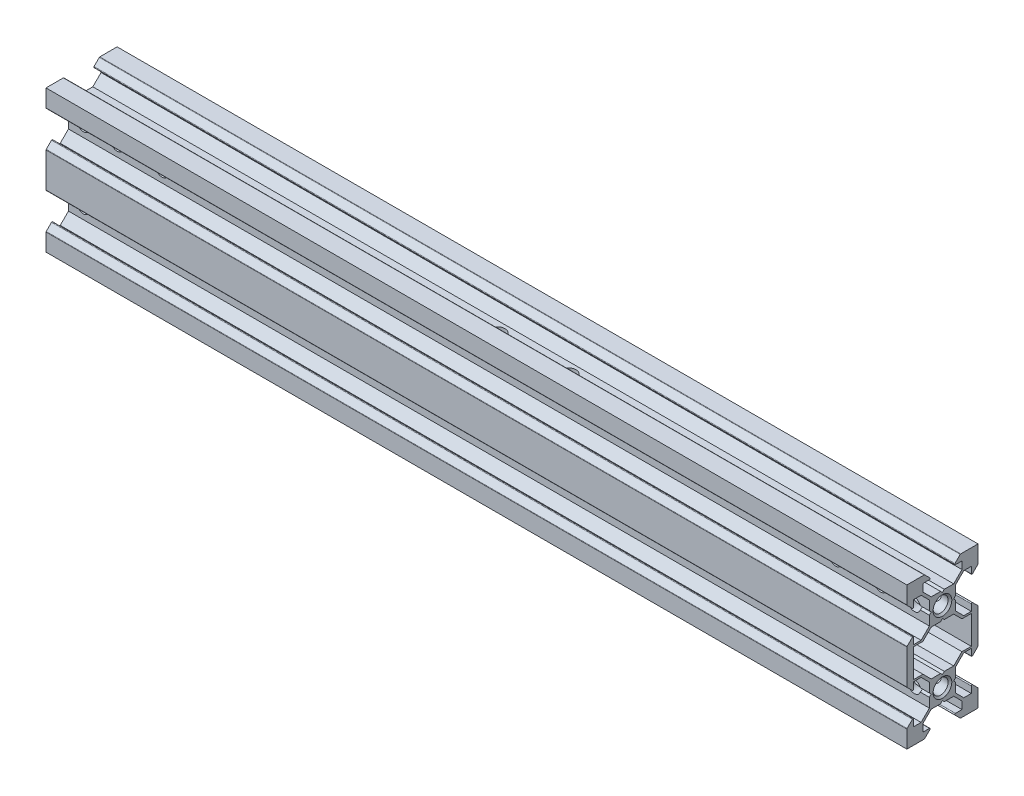
from build123d import *

# Parameters (mm, degrees)
MAIN_BODY_DEPTH       = 115
MAIN_BODY_DEPTH_BACK  = 115
SKETCH2_R             = 2
CHAMFER1_SIZE         = 0.5
CHAMFER2_SIZE         = 0.5
SIDE_HOLES_DEPTH      = 119.858499801
SIDE_HOLES_DEPTH_BACK = 119.858499801
SKETCH3_R             = 1.65
TOP_HOLES_DEPTH       = 10
TOP_HOLES_DEPTH_BACK  = 10
SKETCH4_R             = 2.1


with BuildPart() as part:
    # Sketch2 → Main Body (new, two sides: drawn at the far end of the back side and taken through both)
    with BuildSketch(Plane(origin=(0, 0, 0), x_dir=(0, 0, -1), z_dir=(1, 0, 0)).offset(-MAIN_BODY_DEPTH_BACK)):
        with BuildLine():
            Line((0.5, 3.5), (0, 3))
            Line((0, 3), (-0.5, 3.5))
            Line((-0.5, 3.5), (-3.01, 3.5))
            Line((-3.01, 3.5), (-5.209102089, 5.699102089))
            Line((-5.209102089, 5.699102089), (-5.209102089, 7.699102089))
            Line((-5.209102089, 7.699102089), (-3.479102089, 7.699102089))
            ThreePointArc((-3.479102089, 7.699102089), (-3.294326183, 7.822565403), (-3.337680733, 8.040523446))
            Line((-3.337680733, 8.040523446), (-4.73775216, 9.440594872))
            ThreePointArc((-4.73775216, 9.440594872), (-4.80263683, 9.483949423), (-4.879173516, 9.499173516))
            Line((-4.879173516, 9.499173516), (-9.499173516, 9.499173516))
            Line((-9.499173516, 9.499173516), (-9.499173516, 4.879173516))
            ThreePointArc((-9.499173516, 4.879173516), (-9.483949423, 4.80263683), (-9.440594872, 4.73775216))
            Line((-9.440594872, 4.73775216), (-8.040523446, 3.337680733))
            ThreePointArc((-8.040523446, 3.337680733), (-7.822565403, 3.294326183), (-7.699102089, 3.479102089))
            Line((-7.699102089, 3.479102089), (-7.699102089, 5.209102089))
            Line((-7.699102089, 5.209102089), (-5.699102089, 5.209102089))
            Line((-5.699102089, 5.209102089), (-3.5, 3.01))
            Line((-3.5, 3.01), (-3.5, 0.5))
            Line((-3.5, 0.5), (-3, 0))
            Line((-3, 0), (-3.5, -0.5))
            Line((-3.5, -0.5), (-3.5, -3.01))
            Line((-3.5, -3.01), (-5.699102089, -5.209102089))
            Line((-5.699102089, -5.209102089), (-7.699102089, -5.209102089))
            Line((-7.699102089, -5.209102089), (-7.699102089, -3.479102089))
            ThreePointArc((-7.699102089, -3.479102089), (-7.822565403, -3.294326183), (-8.040523446, -3.337680733))
            Line((-8.040523446, -3.337680733), (-9.440594872, -4.73775216))
            ThreePointArc((-9.440594872, -4.73775216), (-9.483949423, -4.80263683), (-9.499173516, -4.879173516))
            Line((-9.499173516, -4.879173516), (-9.499173516, -14.119173516))
            ThreePointArc((-9.499173516, -14.119173516), (-9.483949423, -14.195710203), (-9.440594872, -14.260594872))
            Line((-9.440594872, -14.260594872), (-8.040523446, -15.660666299))
            ThreePointArc((-8.040523446, -15.660666299), (-7.822565403, -15.704020849), (-7.699102089, -15.519244943))
            Line((-7.699102089, -15.519244943), (-7.699102089, -13.789244943))
            Line((-7.699102089, -13.789244943), (-5.699102089, -13.789244943))
            Line((-5.699102089, -13.789244943), (-3.5, -15.988347032))
            Line((-3.5, -15.988347032), (-3.5, -18.498347032))
            Line((-3.5, -18.498347032), (-3, -18.998347032))
            Line((-3, -18.998347032), (-3.5, -19.498347032))
            Line((-3.5, -19.498347032), (-3.5, -22.008347032))
            Line((-3.5, -22.008347032), (-5.699102089, -24.207449122))
            Line((-5.699102089, -24.207449122), (-7.699102089, -24.207449122))
            Line((-7.699102089, -24.207449122), (-7.699102089, -22.477449122))
            ThreePointArc((-7.699102089, -22.477449122), (-7.822565403, -22.292673215), (-8.040523446, -22.336027766))
            Line((-8.040523446, -22.336027766), (-9.440594872, -23.736099192))
            ThreePointArc((-9.440594872, -23.736099192), (-9.483949423, -23.800983862), (-9.499173516, -23.877520549))
            Line((-9.499173516, -23.877520549), (-9.499173516, -28.497520549))
            Line((-9.499173516, -28.497520549), (-4.879173516, -28.497520549))
            ThreePointArc((-4.879173516, -28.497520549), (-4.80263683, -28.482296455), (-4.73775216, -28.438941905))
            Line((-4.73775216, -28.438941905), (-3.337680733, -27.038870478))
            ThreePointArc((-3.337680733, -27.038870478), (-3.294326183, -26.820912435), (-3.479102089, -26.697449122))
            Line((-3.479102089, -26.697449122), (-5.209102089, -26.697449122))
            Line((-5.209102089, -26.697449122), (-5.209102089, -24.697449122))
            Line((-5.209102089, -24.697449122), (-3.01, -22.498347032))
            Line((-3.01, -22.498347032), (-0.5, -22.498347032))
            Line((-0.5, -22.498347032), (0, -21.998347032))
            Line((0, -21.998347032), (0.5, -22.498347032))
            Line((0.5, -22.498347032), (3.01, -22.498347032))
            Line((3.01, -22.498347032), (5.209102089, -24.697449122))
            Line((5.209102089, -24.697449122), (5.209102089, -26.697449122))
            Line((5.209102089, -26.697449122), (3.479102089, -26.697449122))
            ThreePointArc((3.479102089, -26.697449122), (3.294326183, -26.820912435), (3.337680733, -27.038870478))
            Line((3.337680733, -27.038870478), (4.73775216, -28.438941905))
            ThreePointArc((4.73775216, -28.438941905), (4.80263683, -28.482296455), (4.879173516, -28.497520549))
            Line((4.879173516, -28.497520549), (9.499173516, -28.497520549))
            Line((9.499173516, -28.497520549), (9.499173516, -23.877520549))
            ThreePointArc((9.499173516, -23.877520549), (9.483949423, -23.800983862), (9.440594872, -23.736099192))
            Line((9.440594872, -23.736099192), (8.040523446, -22.336027766))
            ThreePointArc((8.040523446, -22.336027766), (7.822565403, -22.292673215), (7.699102089, -22.477449122))
            Line((7.699102089, -22.477449122), (7.699102089, -24.207449122))
            Line((7.699102089, -24.207449122), (5.699102089, -24.207449122))
            Line((5.699102089, -24.207449122), (3.5, -22.008347032))
            Line((3.5, -22.008347032), (3.5, -19.498347032))
            Line((3.5, -19.498347032), (3, -18.998347032))
            Line((3, -18.998347032), (3.5, -18.498347032))
            Line((3.5, -18.498347032), (3.5, -15.988347032))
            Line((3.5, -15.988347032), (5.699102089, -13.789244943))
            Line((5.699102089, -13.789244943), (7.699102089, -13.789244943))
            Line((7.699102089, -13.789244943), (7.699102089, -15.519244943))
            ThreePointArc((7.699102089, -15.519244943), (7.822565403, -15.704020849), (8.040523446, -15.660666299))
            Line((8.040523446, -15.660666299), (9.440594872, -14.260594872))
            ThreePointArc((9.440594872, -14.260594872), (9.483949423, -14.195710203), (9.499173516, -14.119173516))
            Line((9.499173516, -14.119173516), (9.499173516, -4.879173516))
            ThreePointArc((9.499173516, -4.879173516), (9.483949423, -4.80263683), (9.440594872, -4.73775216))
            Line((9.440594872, -4.73775216), (8.040523446, -3.337680733))
            ThreePointArc((8.040523446, -3.337680733), (7.822565403, -3.294326183), (7.699102089, -3.479102089))
            Line((7.699102089, -3.479102089), (7.699102089, -5.209102089))
            Line((7.699102089, -5.209102089), (5.699102089, -5.209102089))
            Line((5.699102089, -5.209102089), (3.5, -3.01))
            Line((3.5, -3.01), (3.5, -0.5))
            Line((3.5, -0.5), (3, 0))
            Line((3, 0), (3.5, 0.5))
            Line((3.5, 0.5), (3.5, 3.01))
            Line((3.5, 3.01), (5.699102089, 5.209102089))
            Line((5.699102089, 5.209102089), (7.699102089, 5.209102089))
            Line((7.699102089, 5.209102089), (7.699102089, 3.479102089))
            ThreePointArc((7.699102089, 3.479102089), (7.822565403, 3.294326183), (8.040523446, 3.337680733))
            Line((8.040523446, 3.337680733), (9.440594872, 4.73775216))
            ThreePointArc((9.440594872, 4.73775216), (9.483949423, 4.80263683), (9.499173516, 4.879173516))
            Line((9.499173516, 4.879173516), (9.499173516, 9.499173516))
            Line((9.499173516, 9.499173516), (4.879173516, 9.499173516))
            ThreePointArc((4.879173516, 9.499173516), (4.80263683, 9.483949423), (4.73775216, 9.440594872))
            Line((4.73775216, 9.440594872), (3.337680733, 8.040523446))
            ThreePointArc((3.337680733, 8.040523446), (3.294326183, 7.822565403), (3.479102089, 7.699102089))
            Line((3.479102089, 7.699102089), (5.209102089, 7.699102089))
            Line((5.209102089, 7.699102089), (5.209102089, 5.699102089))
            Line((5.209102089, 5.699102089), (3.01, 3.5))
            Line((3.01, 3.5), (0.5, 3.5))
        make_face()
        with Locations((0, -18.998347032)):
            Circle(SKETCH2_R, mode=Mode.SUBTRACT)
        Polygon((-0.5, -3.5), (0, -3), (0.5, -3.5), (3.01, -3.5), (5.209102089, -5.699102089), (7.699102089, -5.699102089), (7.699102089, -13.299244943), (5.209102089, -13.299244943), (3.01, -15.498347032), (0.5, -15.498347032), (0, -15.998347032), (-0.5, -15.498347032), (-3.01, -15.498347032), (-5.209102089, -13.299244943), (-7.699102089, -13.299244943), (-7.699102089, -5.699102089), (-5.209102089, -5.699102089), (-3.01, -3.5), align=None, mode=Mode.SUBTRACT)
        Circle(SKETCH2_R, mode=Mode.SUBTRACT)
    extrude(amount=MAIN_BODY_DEPTH + MAIN_BODY_DEPTH_BACK)

    # Chamfer1
    chamfer1_edges = [part.edges().sort_by_distance(p)[0] for p in [
        (115, 0, 2),
    ]]
    chamfer(chamfer1_edges, length=CHAMFER1_SIZE)

    # Chamfer2
    chamfer2_edges = [part.edges().sort_by_distance(p)[0] for p in [
        (-115, 0, 2),
        (115, -18.998347032, 2),
        (-115, -18.998347032, 2),
    ]]
    chamfer(chamfer2_edges, length=CHAMFER2_SIZE)

    # Sketch3 → Side Holes (cut, two sides: drawn at the far end of the back side and taken through both)
    with BuildSketch(Plane.XY.offset(-SIDE_HOLES_DEPTH_BACK)):
        with Locations((-111, 0)):
            Circle(SKETCH3_R)
        with Locations((-111, -18.998347032)):
            Circle(SKETCH3_R)
        with Locations((-102, 0)):
            Circle(SKETCH3_R)
        with Locations((-90, 0)):
            Circle(SKETCH3_R)
        with Locations((111, -18.998347032)):
            Circle(SKETCH3_R)
        with Locations((111, 0)):
            Circle(SKETCH3_R)
        with Locations((102, 0)):
            Circle(SKETCH3_R)
        with Locations((90, 0)):
            Circle(SKETCH3_R)
    extrude(amount=SIDE_HOLES_DEPTH + SIDE_HOLES_DEPTH_BACK, mode=Mode.SUBTRACT)

    # Sketch4 → Top Holes (cut, two sides: drawn at the far end of the back side and taken through both)
    with BuildSketch(Plane(origin=(0, 0, 0), x_dir=(1, 0, 0), z_dir=(0, 1, 0)).offset(-TOP_HOLES_DEPTH_BACK)):
        with Locations((-4, 0)):
            Circle(SKETCH4_R)
        with Locations((15, 0)):
            Circle(SKETCH4_R)
    extrude(amount=TOP_HOLES_DEPTH + TOP_HOLES_DEPTH_BACK, mode=Mode.SUBTRACT)


solid = part.part
